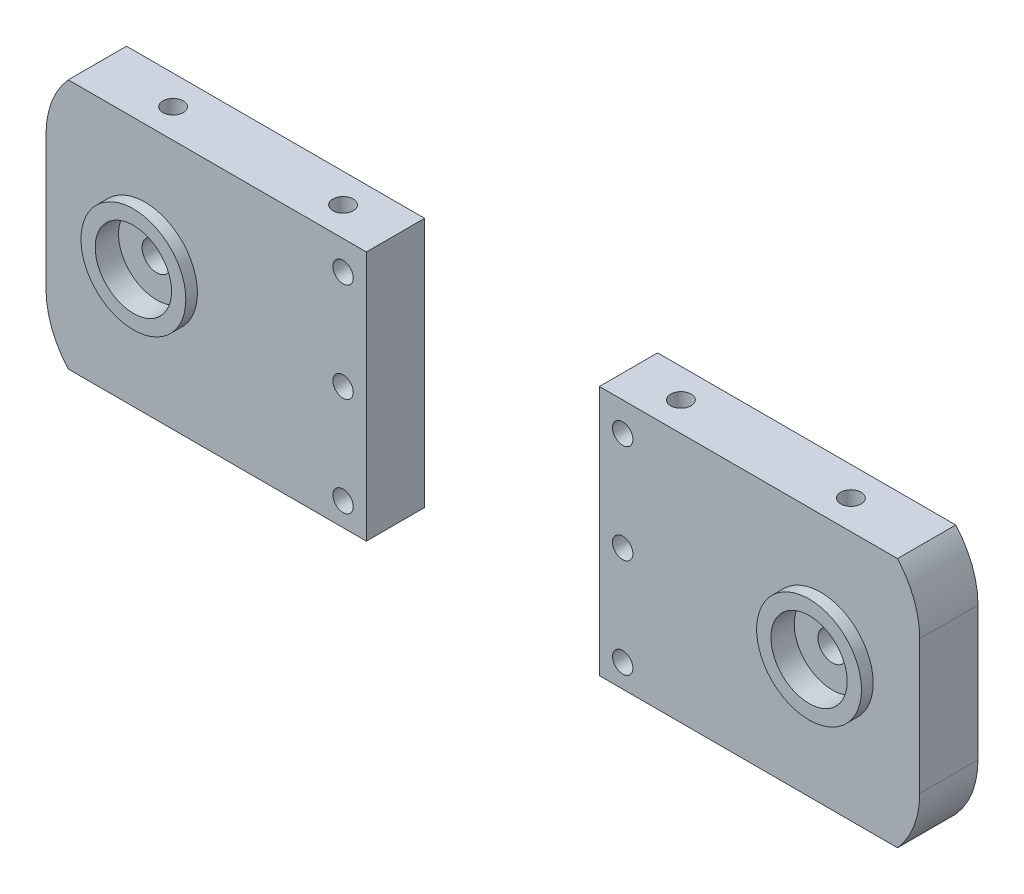
from build123d import *

# Parameters (mm, degrees)
IZIM1_W                      = 40
IZIM1_H                      = 43
IZIM1_R                      = 12.5
IZIM1_R_2                    = 1.75
Y_KSEKLIK_EKSTR_ZYON1_DEPTH  = 10
Y_KSEKLIK_EKSTR_ZYON8_START  = -4
IZIM7_R                      = 12.5
IZIM7_R_2                    = 2.5
Y_KSEKLIK_EKSTR_ZYON8_DEPTH  = 4
IZIM8_R                      = 9
IZIM8_R_2                    = 6.55
Y_KSEKLIK_EKSTR_ZYON9_DEPTH  = 4
L_O_ALTMA1_COUNT             = 2
L_O_ALTMA1_PITCH             = 116
KES_EKSTR_ZYON3_START        = -10
KES_EKSTR_ZYON3_DEPTH        = 10
IZIM13_R                     = 12.5
IZIM13_R_2                   = 9
Y_KSEKLIK_EKSTR_ZYON10_DEPTH = 2
IZIM12_R                     = 1.75
KES_EKSTR_ZYON4_DEPTH        = 10
IZIM14_R                     = 1.75
KES_EKSTR_ZYON5_DEPTH        = 10


with BuildPart() as part:
    # Çizim1 → Yükseklik-Ekstrüzyon1 (new body)
    with BuildSketch(Plane.XY):
        with BuildLine():
            ThreePointArc((0, 15), (4.393398282, 4.393398282), (15, 0))
            Line((15, 0), (135, 0))
            ThreePointArc((135, 0), (145.606601718, 4.393398282), (150, 15))
            Line((150, 15), (150, 38))
            ThreePointArc((150, 38), (145.606601718, 48.606601718), (135, 53))
            Line((135, 53), (15, 53))
            ThreePointArc((15, 53), (4.393398282, 48.606601718), (0, 38))
            Line((0, 38), (0, 15))
        make_face()
        with Locations((75, 26.5)):
            Rectangle(IZIM1_W, IZIM1_H, mode=Mode.SUBTRACT)
        with Locations((17, 27.41)):
            Circle(IZIM1_R, mode=Mode.SUBTRACT)
        with Locations((51, 43)):
            Circle(IZIM1_R_2, mode=Mode.SUBTRACT)
        with Locations((51, 9)):
            Circle(IZIM1_R_2, mode=Mode.SUBTRACT)
        with Locations((51, 26)):
            Circle(IZIM1_R_2, mode=Mode.SUBTRACT)
        with Locations((133, 27.41)):
            Circle(IZIM1_R, mode=Mode.SUBTRACT)
        with Locations((99, 26)):
            Circle(IZIM1_R_2, mode=Mode.SUBTRACT)
        with Locations((99, 9)):
            Circle(IZIM1_R_2, mode=Mode.SUBTRACT)
        with Locations((99, 43)):
            Circle(IZIM1_R_2, mode=Mode.SUBTRACT)
    extrude(amount=Y_KSEKLIK_EKSTR_ZYON1_DEPTH)

    # Çizim7 → Yükseklik-Ekstrüzyon8 (add)
    with BuildSketch(Plane(origin=(0, 0, 0), x_dir=(-1, 0, 0), z_dir=(0, 0, -1)).offset(Y_KSEKLIK_EKSTR_ZYON8_START)):
        with Locations((-133, 27.41)):
            Circle(IZIM7_R)
        with Locations((-133, 27.41)):
            Circle(IZIM7_R_2, mode=Mode.SUBTRACT)
    y_kseklik_ekstr_zyon8 = extrude(amount=-Y_KSEKLIK_EKSTR_ZYON8_DEPTH)

    # Çizim8 → Yükseklik-Ekstrüzyon9 (add)
    with BuildSketch(Plane.XY.offset(8)):
        with Locations(Location((133, 27.41, 0), (0, 0, 180))):
            Circle(IZIM8_R)
        with Locations((133, 27.41)):
            Circle(IZIM8_R_2, mode=Mode.SUBTRACT)
    y_kseklik_ekstr_zyon9 = extrude(amount=Y_KSEKLIK_EKSTR_ZYON9_DEPTH)

    # LÇoğaltma1: Yükseklik-Ekstrüzyon8, Yükseklik-Ekstrüzyon9 ×2
    with Locations(*[(-i * L_O_ALTMA1_PITCH, 0, 0) for i in range(1, L_O_ALTMA1_COUNT)]):
        add(y_kseklik_ekstr_zyon8)
        add(y_kseklik_ekstr_zyon9)

    # Çizim11 → Kes-Ekstrüzyon3 (cut)
    with BuildSketch(Plane.XY.offset(10).offset(KES_EKSTR_ZYON3_START)):
        with BuildLine():
            Line((146.180339887, 48), (150, 48))
            Line((150, 48), (156.054550849, 48))
            Line((156.054550849, 48), (156.054550849, 62.600281878))
            Line((156.054550849, 62.600281878), (0, 62.600281878))
            Line((0, 62.600281878), (0, 48))
            Line((0, 48), (3.819660113, 48))
            ThreePointArc((3.819660113, 48), (8.876275643, 51.693063938), (15, 53))
            Line((15, 53), (135, 53))
            ThreePointArc((135, 53), (141.123724357, 51.693063938), (146.180339887, 48))
        make_face()
        with BuildLine():
            Line((95, 48), (146.180339887, 48))
            ThreePointArc((146.180339887, 48), (141.123724357, 51.693063938), (135, 53))
            Line((135, 53), (15, 53))
            ThreePointArc((15, 53), (8.876275643, 51.693063938), (3.819660113, 48))
            Line((3.819660113, 48), (55, 48))
            Line((55, 48), (95, 48))
        make_face()
        with BuildLine():
            Line((146.180339887, 5), (95, 5))
            Line((95, 5), (55, 5))
            Line((55, 5), (3.819660113, 5))
            ThreePointArc((3.819660113, 5), (8.876275643, 1.306936062), (15, 0))
            Line((15, 0), (135, 0))
            ThreePointArc((135, 0), (141.123724357, 1.306936062), (146.180339887, 5))
        make_face()
        with BuildLine():
            Line((150, 5), (146.180339887, 5))
            ThreePointArc((146.180339887, 5), (141.123724357, 1.306936062), (135, 0))
            Line((135, 0), (15, 0))
            ThreePointArc((15, 0), (8.876275643, 1.306936062), (3.819660113, 5))
            Line((3.819660113, 5), (0, 5))
            Line((0, 5), (0, -18.687777451))
            Line((0, -18.687777451), (161.997781601, -18.687777451))
            Line((161.997781601, -18.687777451), (161.997781601, 5))
            Line((161.997781601, 5), (150, 5))
        make_face()
    extrude(amount=KES_EKSTR_ZYON3_DEPTH, mode=Mode.SUBTRACT)


with BuildPart() as kes_ekstr_zyon3_piece_1:
    # of the separate pieces the step leaves, piece 1, a body of its own (kes_ekstr_zyon3_pieces)
    add(part.part.solids().sort_by_distance((95, 48, 0))[0])



with BuildPart() as kes_ekstr_zyon3_piece_2:
    # of the separate pieces the step leaves, piece 2, a body of its own (kes_ekstr_zyon3_pieces)
    add(part.part.solids().sort_by_distance((0, 38, 0))[0])


with BuildPart() as kes_ekstr_zyon3_piece_1_1:
    add(kes_ekstr_zyon3_piece_1.part)

    add(kes_ekstr_zyon3_piece_2.part)  # Yükseklik-Ekstrüzyon10 merges Kes-Ekstrüzyon3 piece 2
    # Çizim13 → Yükseklik-Ekstrüzyon10 (add)
    # profile 1 of 2: a face of its own
    with BuildSketch(Plane.XY.offset(8)):
        with Locations(Location((133, 27.41, 0), (0, 0, 180))):
            Circle(IZIM13_R)
        with Locations((133, 27.41)):
            Circle(IZIM13_R_2, mode=Mode.SUBTRACT)
    # profile 2 of 2: a face of its own
    with BuildSketch(Plane.XY.offset(8)):
        with Locations(Location((17, 27.41, 0), (0, 0, 180))):
            Circle(IZIM13_R)
        with Locations((17, 27.41)):
            Circle(IZIM13_R_2, mode=Mode.SUBTRACT)
    extrude(amount=Y_KSEKLIK_EKSTR_ZYON10_DEPTH)

    # Çizim12 → Kes-Ekstrüzyon4 (cut)
    with BuildSketch(Plane(origin=(0, 48, 0), x_dir=(1, 0, 0), z_dir=(0, 1, 0))):
        with Locations(Location((46, -5, 0), (0, 0, 270))):
            Circle(IZIM12_R)
        with Locations(Location((16.819660113, -5, 0), (0, 0, 270))):
            Circle(IZIM12_R)
        with Locations(Location((104, -5, 0), (0, 0, 270))):
            Circle(IZIM12_R)
        with Locations(Location((133.180339887, -5, 0), (0, 0, 270))):
            Circle(IZIM12_R)
    extrude(amount=-KES_EKSTR_ZYON4_DEPTH, mode=Mode.SUBTRACT)

    # Çizim14 → Kes-Ekstrüzyon5 (cut)
    with BuildSketch(Plane.XZ.offset(-5)):
        with Locations(Location((16.819660113, 5, 0), (0, 0, 90))):
            Circle(IZIM14_R)
        with Locations(Location((46, 5, 0), (0, 0, 90))):
            Circle(IZIM14_R)
        with Locations(Location((104, 5, 0), (0, 0, 90))):
            Circle(IZIM14_R)
        with Locations(Location((133.180339887, 5, 0), (0, 0, 90))):
            Circle(IZIM14_R)
    extrude(amount=-KES_EKSTR_ZYON5_DEPTH, mode=Mode.SUBTRACT)


solid = kes_ekstr_zyon3_piece_1_1.part
